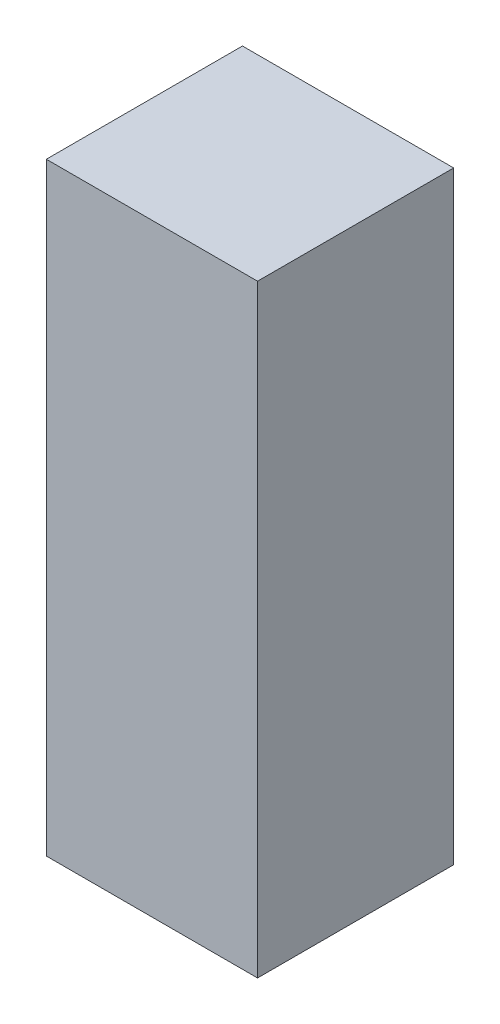
from build123d import *

# Parameters (mm, degrees)
PRESS_KOVA_KAPAGI_MENTESE_2_1_START = 20
SKETCH1_W                           = 14
SKETCH1_H                           = 40
PRESS_KOVA_KAPAGI_MENTESE_2_1_DEPTH = 13


with BuildPart() as part:
    # Sketch1 → PRESS_kova_kapagi_mentese_2_1 (new body)
    with BuildSketch(Plane.XY.offset(PRESS_KOVA_KAPAGI_MENTESE_2_1_START)):
        with Locations((31, 1720)):
            Rectangle(SKETCH1_W, SKETCH1_H)
    extrude(amount=PRESS_KOVA_KAPAGI_MENTESE_2_1_DEPTH)


solid = part.part
